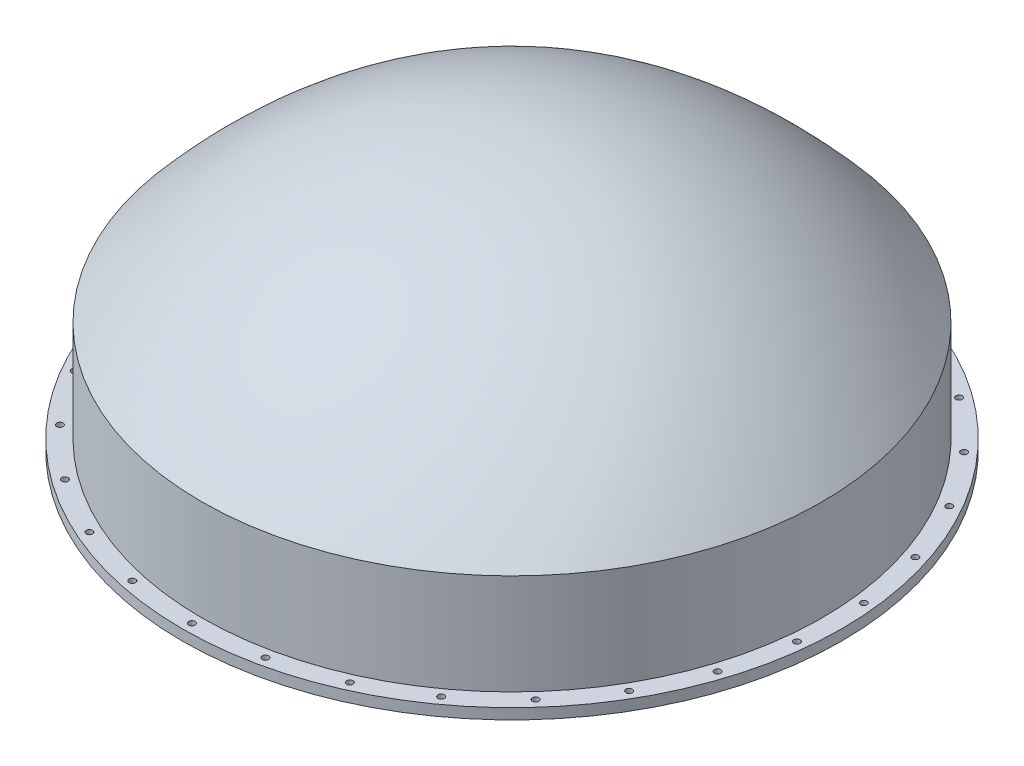
from build123d import *

# Parameters (mm, degrees)
SKETCH2_R          = 22
CUT_EXTRUDE1_DEPTH = 73


with BuildPart() as part:
    # Sketch1 → Revolve1 (revolve)
    with BuildSketch(Plane(origin=(0, 0, 0), x_dir=(0, 0, -1), z_dir=(1, 0, 0))):
        with BuildLine():
            Line((-2081.13, 0), (-2081.13, -744.115))
            Line((-2081.13, -744.115), (-2262.02, -744.115))
            Line((-2262.02, -744.115), (-2262.02, -671.115))
            Line((-2262.02, -671.115), (-2130.02, -671.115))
            Line((-2130.02, -671.115), (-2130.02, 18.415372076))
            add(Edge.make_bspline(
                [(0, 1093.3), (-12.418531649, 1093.3), (-37.283102867, 1093.124506628), (-86.784740091, 1092.071296895), (-148.389450242, 1089.4376737), (-221.82738147, 1084.168741322), (-294.787163283, 1076.790306916), (-367.26166327, 1067.301749848), (-463.243524685, 1051.83648479), (-581.990457486, 1027.228866429), (-722.487645159, 989.262489985), (-860.956252193, 942.868882081), (-997.369740081, 888.06276822), (-1131.705608847, 824.862652115), (-1263.94622322, 753.289552123), (-1394.079145113, 673.365687326), (-1522.097039866, 585.113245612), (-1647.99724055, 488.553344972), (-1751.150419726, 401.179969583), (-1832.617055424, 327.145648307), (-1893.189915497, 269.553940492), (-1953.236547644, 209.898020733), (-2002.837816956, 158.465798182), (-2042.256661184, 116.289520895), (-2066.784684514, 89.499732696), (-2086.341038556, 67.811118948), (-2098.538142559, 54.146811743), (-2108.275835731, 43.154775618), (-2114.363464888, 36.249341412), (-2119.210319881, 30.728598375), (-2124.007437931, 25.26419068), (-2127.616467281, 21.153209457), (-2130.02, 18.415372076)],
                knots=[0, 0, 0, 0, 0.015728521, 0.031457041, 0.062914083, 0.094371124, 0.125828165, 0.157285207, 0.188742248, 0.251656331, 0.314570414, 0.377484496, 0.440398579, 0.503312662, 0.566226745, 0.629140827, 0.69205491, 0.754968993, 0.817883076, 0.849340117, 0.880797158, 0.9122542, 0.943711241, 0.959439762, 0.975168283, 0.983032543, 0.990896803, 0.994828933, 0.998761064, 1.000727129, 1.002693194, 1.006625324, 1.006625324, 1.006625324, 1.006625324], degree=3))
            Line((0, 1093.3), (0, 1044.41))
            add(Edge.make_bspline(
                [(0, 1044.41), (-1164.248075476, 1044.41), (-2081.13, 0)],
                knots=[0, 0, 0, 1, 1, 1], degree=2))
        make_face()
    revolve(axis=Axis((0, 1093.3, 0), (0, -1, 0)))

    # Sketch2 → Cut-Extrude1 (cut)
    with BuildSketch(Plane.XZ.offset(744.115)):
        with Locations(Location((0, 2196.0235, 0), (0, 0, 270))):
            Circle(SKETCH2_R)
        with Locations(Location((456.578958961, 2148.03511768, 0), (0, 0, 270))):
            Circle(SKETCH2_R)
        with Locations(Location((893.203226506, 2006.167293301, 0), (0, 0, 270))):
            Circle(SKETCH2_R)
        with Locations(Location((1290.790226988, 1776.620331547, 0), (0, 0, 270))):
            Circle(SKETCH2_R)
        with Locations(Location((1631.963500652, 1469.426536133, 0), (0, 0, 270))):
            Circle(SKETCH2_R)
        with Locations(Location((1901.812138308, 1098.01175, 0), (0, 0, 270))):
            Circle(SKETCH2_R)
        with Locations(Location((2088.542459612, 678.608581547, 0), (0, 0, 270))):
            Circle(SKETCH2_R)
        with Locations(Location((2183.993453493, 229.546961755, 0), (0, 0, 270))):
            Circle(SKETCH2_R)
        with Locations(Location((2183.993453493, -229.546961755, 0), (0, 0, 270))):
            Circle(SKETCH2_R)
        with Locations(Location((2088.542459612, -678.608581547, 0), (0, 0, 270))):
            Circle(SKETCH2_R)
        with Locations(Location((1901.812138308, -1098.01175, 0), (0, 0, 270))):
            Circle(SKETCH2_R)
        with Locations(Location((1631.963500652, -1469.426536133, 0), (0, 0, 270))):
            Circle(SKETCH2_R)
        with Locations(Location((1290.790226988, -1776.620331547, 0), (0, 0, 270))):
            Circle(SKETCH2_R)
        with Locations(Location((893.203226506, -2006.167293301, 0), (0, 0, 270))):
            Circle(SKETCH2_R)
        with Locations(Location((456.578958961, -2148.03511768, 0), (0, 0, 270))):
            Circle(SKETCH2_R)
        with Locations(Location((0, -2196.0235, 0), (0, 0, 270))):
            Circle(SKETCH2_R)
        with Locations(Location((-456.57895896, -2148.03511768, 0), (0, 0, 270))):
            Circle(SKETCH2_R)
        with Locations(Location((-893.203226505, -2006.167293301, 0), (0, 0, 270))):
            Circle(SKETCH2_R)
        with Locations(Location((-1290.790226988, -1776.620331547, 0), (0, 0, 270))):
            Circle(SKETCH2_R)
        with Locations(Location((-1631.963500652, -1469.426536133, 0), (0, 0, 270))):
            Circle(SKETCH2_R)
        with Locations(Location((-1901.812138308, -1098.01175, 0), (0, 0, 270))):
            Circle(SKETCH2_R)
        with Locations(Location((-2088.542459612, -678.608581547, 0), (0, 0, 270))):
            Circle(SKETCH2_R)
        with Locations(Location((-2183.993453493, -229.546961755, 0), (0, 0, 270))):
            Circle(SKETCH2_R)
        with Locations(Location((-2183.993453493, 229.546961755, 0), (0, 0, 270))):
            Circle(SKETCH2_R)
        with Locations(Location((-2088.542459612, 678.608581547, 0), (0, 0, 270))):
            Circle(SKETCH2_R)
        with Locations(Location((-1901.812138308, 1098.01175, 0), (0, 0, 270))):
            Circle(SKETCH2_R)
        with Locations(Location((-1631.963500652, 1469.426536133, 0), (0, 0, 270))):
            Circle(SKETCH2_R)
        with Locations(Location((-1290.790226988, 1776.620331547, 0), (0, 0, 270))):
            Circle(SKETCH2_R)
        with Locations(Location((-893.203226506, 2006.167293301, 0), (0, 0, 270))):
            Circle(SKETCH2_R)
        with Locations(Location((-456.578958961, 2148.03511768, 0), (0, 0, 270))):
            Circle(SKETCH2_R)
    extrude(amount=-CUT_EXTRUDE1_DEPTH, mode=Mode.SUBTRACT)


solid = part.part
